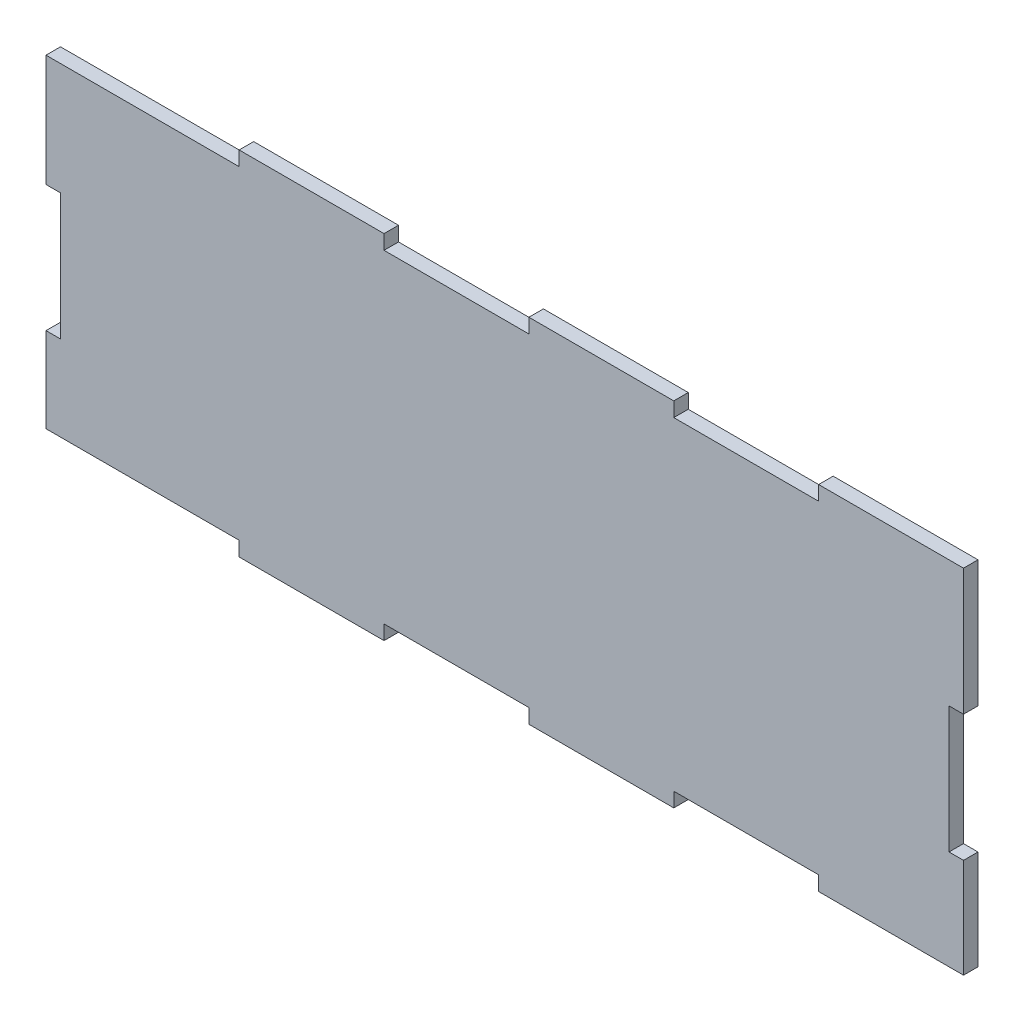
from build123d import *

# Parameters (mm, degrees)
BOSS_EXTRUDE1_DEPTH = 3


with BuildPart() as part:
    # Sketch1 → Boss-Extrude1 (new body)
    with BuildSketch(Plane.XY):
        Polygon((30, 70), (0, 70), (-10, 70), (-10, 46.8), (-7, 46.8), (-7, 20.6), (-10, 20.6), (-10, 3), (0, 3), (30, 3), (30, 0), (60, 0), (60, 3), (90, 3), (90, 0), (120, 0), (120, 3), (150, 3), (150, 0), (180, 0), (180, 20.6), (177, 20.6), (177, 46.8), (180, 46.8), (180, 73), (150, 73), (150, 70), (120, 70), (120, 73), (90, 73), (90, 70), (60, 70), (60, 73), (30, 73), align=None)
    extrude(amount=BOSS_EXTRUDE1_DEPTH)


solid = part.part
